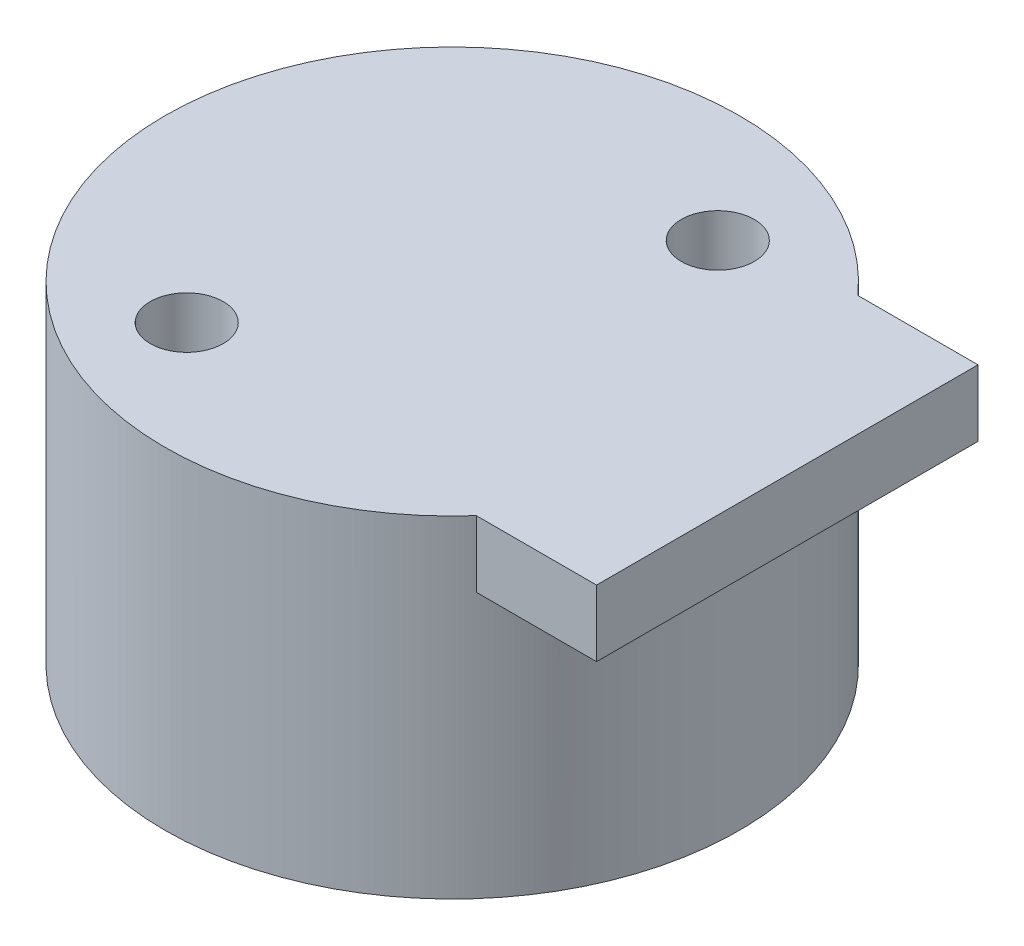
from build123d import *

# Parameters (mm, degrees)
SKETCH1_R           = 10.9982
SKETCH1_R_2         = 1.397
BOSS_EXTRUDE1_DEPTH = 12.7
SKETCH2_W           = 4.603016963
SKETCH2_H           = 14.605
BOSS_EXTRUDE2_DEPTH = 2.54


with BuildPart() as part:
    # Sketch1 → Boss-Extrude1 (new body)
    with BuildSketch(Plane(origin=(0, 0, 0), x_dir=(1, 0, 0), z_dir=(0, 1, 0))):
        with Locations(Location((0, 0, 0), (0, 0, 270))):
            Circle(SKETCH1_R)
        with Locations(Location((3.7211, 6.44513426, 0), (0, 0, 270))):
            Circle(SKETCH1_R_2, mode=Mode.SUBTRACT)
        with Locations(Location((-3.7211, -6.44513426, 0), (0, 0, 270))):
            Circle(SKETCH1_R_2, mode=Mode.SUBTRACT)
    extrude(amount=BOSS_EXTRUDE1_DEPTH)

    # Sketch2 → Boss-Extrude2 (add)
    with BuildSketch(Plane(origin=(0, 12.7, 0), x_dir=(1, 0, 0), z_dir=(0, 1, 0))):
        with Locations((10.525491519, 0)):
            Rectangle(SKETCH2_W, SKETCH2_H)
    extrude(amount=-BOSS_EXTRUDE2_DEPTH)


solid = part.part
